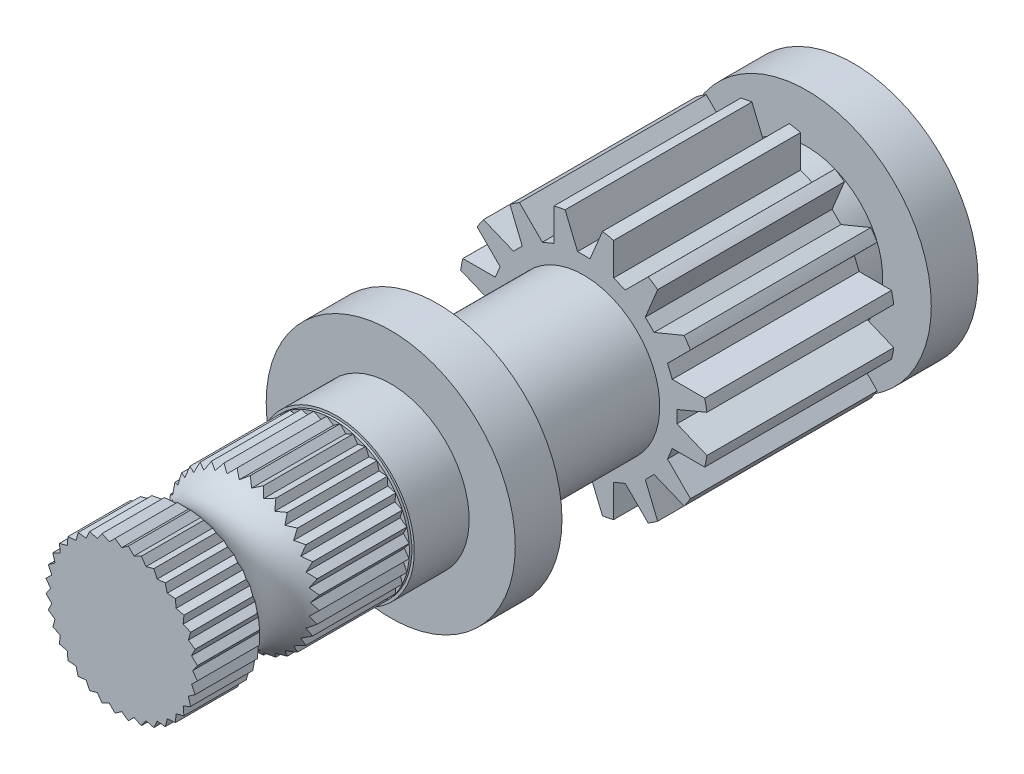
from build123d import *

# Parameters (mm, degrees)
CUT_EXTRUDE1_DEPTH             = 21.59
CIRPATTERN1_COUNT              = 36
CUT_EXTRUDE2_REACH             = 61.421
CUT_EXTRUDE2_DIRECTION_2_REACH = 61.421
CIRPATTERN2_COUNT              = 16


with BuildPart() as part:
    # Sketch1 → Revolve1 (revolve)
    with BuildSketch(Plane(origin=(0, 0, 0), x_dir=(1, 0, 0), z_dir=(0, 1, 0)), mode=Mode.PRIVATE) as revolve1_sk:
        with BuildLine():
            Line((0, 17.9705), (12.7, 17.9705))
            Line((12.7, 17.9705), (12.7, 13.208))
            Line((12.7, 13.208), (7.747, 13.208))
            Line((7.747, 13.208), (7.747, 9.525))
            Line((7.747, 9.525), (12.7, 9.525))
            Line((12.7, 9.525), (12.7, -9.525))
            Line((12.7, -9.525), (7.747, -9.525))
            Line((7.747, -9.525), (7.747, -24.4475))
            Line((7.747, -24.4475), (12.7, -24.4475))
            Line((12.7, -24.4475), (12.7, -29.21))
            Line((12.7, -29.21), (8.001, -29.21))
            Line((8.001, -29.21), (8.001, -34.798))
            Line((8.001, -34.798), (7.747, -34.798))
            Line((7.747, -34.798), (7.747, -44.196))
            ThreePointArc((7.747, -44.196), (6.223, -47.244), (7.747, -50.292))
            Line((7.747, -50.292), (7.747, -56.642))
            Line((7.747, -56.642), (0, -56.642))
            Line((0, -56.642), (0, 17.9705))
        make_face()
    revolve(revolve1_sk.sketch.rotate(Axis((0, 0, 0), (0, 0, 1)), 180), axis=Axis((0, 0, 0), (0, 0, 1)))

    # Sketch2 → Cut-Extrude1 (cut)
    with BuildSketch(Plane.XY.offset(56.642)):
        with BuildLine():
            Line((-0.675195539, 7.717520326), (0, 7.239))
            Line((0, 7.239), (0.675195539, 7.717520326))
            ThreePointArc((0.675195539, 7.717520326), (0, 7.747), (-0.675195539, 7.717520326))
        make_face()
    cut_extrude1 = extrude(amount=-CUT_EXTRUDE1_DEPTH, mode=Mode.SUBTRACT)

    # CirPattern1: Cut-Extrude1 ×36 about axis
    cirpattern1_axis = Axis((0, 0, 0), (0, 0, 1))
    for i in range(1, CIRPATTERN1_COUNT):
        add(cut_extrude1.rotate(cirpattern1_axis, i * 360 / CIRPATTERN1_COUNT), mode=Mode.SUBTRACT)

    # Sketch3 → Cut-Extrude2 (cut, up to next)
    with BuildSketch(Plane.XY, mode=Mode.PRIVATE) as cut_extrude2_sk1:
        with BuildLine():
            Line((-1.905, 12.556312158), (-0.635, 9.503809762))
            Line((-0.635, 9.503809762), (0.635, 9.503809762))
            Line((0.635, 9.503809762), (1.905, 12.556312158))
            ThreePointArc((1.905, 12.556312158), (0, 12.7), (-1.905, 12.556312158))
        make_face()
    cut_extrude2_tool1 = extrude(cut_extrude2_sk1.sketch, amount=-CUT_EXTRUDE2_REACH, mode=Mode.PRIVATE) & part.part
    cut_extrude2 = cut_extrude2_tool1.solids().sort_by_distance((0, 11.344265, 0))[0]
    add(cut_extrude2, mode=Mode.SUBTRACT)

    # Sketch3 → Cut-Extrude2 direction 2 (cut, up to next)
    with BuildSketch(Plane.XY, mode=Mode.PRIVATE) as cut_extrude2_direction_2_sk1:
        with BuildLine():
            Line((-1.905, 12.556312158), (-0.635, 9.503809762))
            Line((-0.635, 9.503809762), (0.635, 9.503809762))
            Line((0.635, 9.503809762), (1.905, 12.556312158))
            ThreePointArc((1.905, 12.556312158), (0, 12.7), (-1.905, 12.556312158))
        make_face()
    cut_extrude2_direction_2_tool1 = extrude(cut_extrude2_direction_2_sk1.sketch, amount=CUT_EXTRUDE2_DIRECTION_2_REACH, mode=Mode.PRIVATE) & part.part
    cut_extrude2_direction_2 = cut_extrude2_direction_2_tool1.solids().sort_by_distance((0, 11.344265, 0))[0]
    add(cut_extrude2_direction_2, mode=Mode.SUBTRACT)

    # CirPattern2: Cut-Extrude2, Cut-Extrude2 direction 2 ×16 about axis
    cirpattern2_axis = Axis((0, 0, 0), (0, 0, 1))
    add([cut_extrude2.rotate(cirpattern2_axis, i * 360 / CIRPATTERN2_COUNT) for i in range(1, CIRPATTERN2_COUNT)], mode=Mode.SUBTRACT)
    add([cut_extrude2_direction_2.rotate(cirpattern2_axis, i * 360 / CIRPATTERN2_COUNT) for i in range(1, CIRPATTERN2_COUNT)], mode=Mode.SUBTRACT)


solid = part.part
